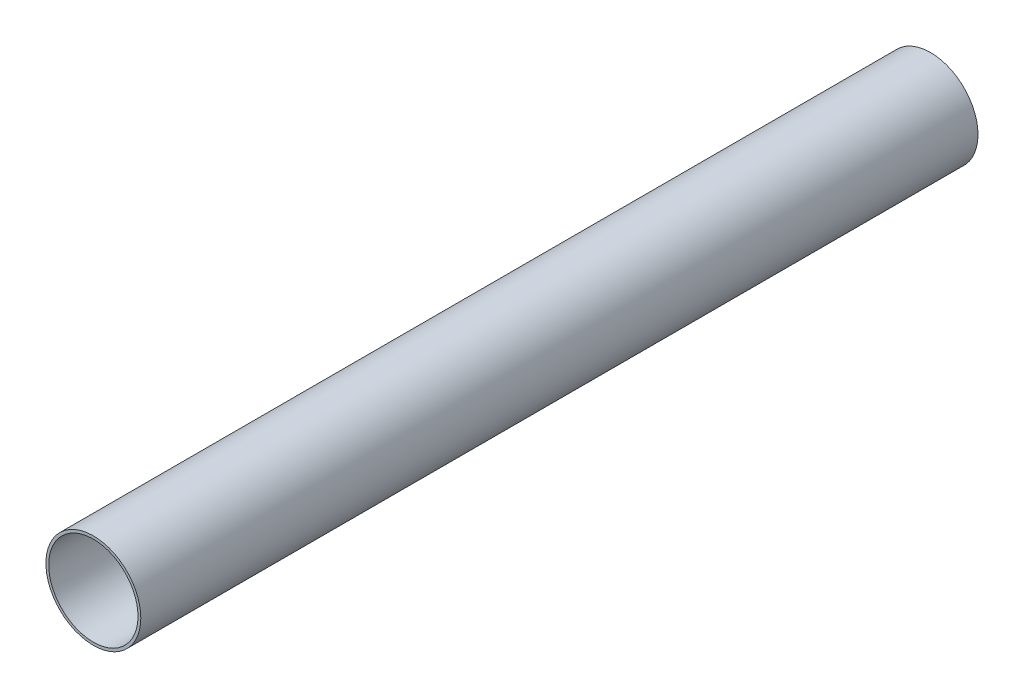
from build123d import *

# Parameters (mm, degrees)
SKETCH1_R           = 17
SKETCH1_R_2         = 16
BOSS_EXTRUDE1_DEPTH = 300


with BuildPart() as part:
    # Sketch1 → Boss-Extrude1 (new body)
    with BuildSketch(Plane.XY):
        Circle(SKETCH1_R)
        Circle(SKETCH1_R_2, mode=Mode.SUBTRACT)
    extrude(amount=BOSS_EXTRUDE1_DEPTH)


solid = part.part
